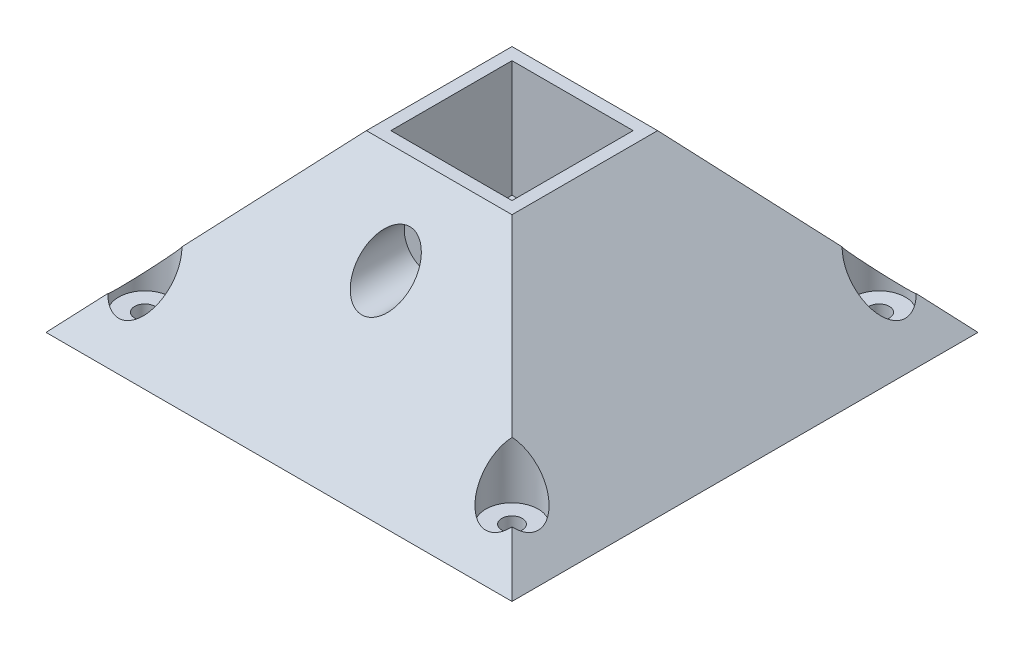
from build123d import *

# Parameters (mm, degrees)
SKETCH3_W          = 20.8
SKETCH3_H          = 20.8
CUT_EXTRUDE1_DEPTH = 20
SKETCH4_R          = 1.75
CUT_EXTRUDE2_DEPTH = 65.031242546
CUT_EXTRUDE5_START = 14
SKETCH4_3_R        = 4.5
SKETCH4_3_R_2      = 1.75
CUT_EXTRUDE5_DEPTH = 51.031242546
SKETCH5_R          = 1.75
CUT_EXTRUDE6_DEPTH = 65.031242546
CUT_EXTRUDE7_START = 3
SKETCH5_3_R        = 4.5
SKETCH5_3_R_2      = 1.75
CUT_EXTRUDE7_DEPTH = 62.031242546
CIRPATTERN1_COUNT  = 4


with BuildPart() as part:
    # Sketch2 → Loft1 section 0
    with BuildSketch(Plane(origin=(0, 30, 0), x_dir=(1, 0, 0), z_dir=(0, 1, 0))):
        with BuildLine():
            Line((12.5, -12.5), (-12.5, -12.5))
            Line((-12.5, -12.5), (-12.5, 12.5))
            Line((-12.5, 12.5), (12.5, 12.5))
            Line((12.5, 12.5), (12.5, -12.5))
        make_face()
    # Sketch1 → Loft1 section 1
    with BuildSketch(Plane(origin=(0, 0, 0), x_dir=(1, 0, 0), z_dir=(0, 1, 0))):
        with BuildLine():
            Line((40, -40), (-40, -40))
            Line((-40, -40), (-40, 40))
            Line((-40, 40), (40, 40))
            Line((40, 40), (40, -40))
        make_face()
    loft()

    # Sketch3 → Cut-Extrude1 (cut)
    with BuildSketch(Plane(origin=(0, 30, 0), x_dir=(1, 0, 0), z_dir=(0, 1, 0))):
        Rectangle(SKETCH3_W, SKETCH3_H)
    extrude(amount=-CUT_EXTRUDE1_DEPTH, mode=Mode.SUBTRACT)

    # Sketch4 → Cut-Extrude2 (cut, through all)
    with BuildSketch(Plane.XY):
        with Locations((0, 20)):
            Circle(SKETCH4_R)
    extrude(amount=CUT_EXTRUDE2_DEPTH, mode=Mode.SUBTRACT)

    # Sketch4<3> → Cut-Extrude5 (cut, through all)
    with BuildSketch(Plane.XY.offset(CUT_EXTRUDE5_START)):
        with Locations((0, 20)):
            Circle(SKETCH4_3_R)
        with Locations((0, 20)):
            Circle(SKETCH4_3_R_2, mode=Mode.SUBTRACT)
    extrude(amount=CUT_EXTRUDE5_DEPTH, mode=Mode.SUBTRACT)

    # Sketch5 → Cut-Extrude6 (cut, through all)
    with BuildSketch(Plane(origin=(0, 0, 0), x_dir=(1, 0, 0), z_dir=(0, 1, 0))):
        with Locations((-31.514718626, 31.514718626)):
            Circle(SKETCH5_R)
    cut_extrude6 = extrude(amount=CUT_EXTRUDE6_DEPTH, mode=Mode.SUBTRACT)

    # Sketch5<3> → Cut-Extrude7 (cut, through all)
    with BuildSketch(Plane(origin=(0, 0, 0), x_dir=(1, 0, 0), z_dir=(0, 1, 0)).offset(CUT_EXTRUDE7_START)):
        with Locations((-31.514718626, 31.514718626)):
            Circle(SKETCH5_3_R)
        with Locations((-31.514718626, 31.514718626)):
            Circle(SKETCH5_3_R_2, mode=Mode.SUBTRACT)
    cut_extrude7 = extrude(amount=CUT_EXTRUDE7_DEPTH, mode=Mode.SUBTRACT)

    # CirPattern1: Cut-Extrude6, Cut-Extrude7 ×4 about axis
    cirpattern1_axis = Axis((0, 0, 0), (0, 1, 0))
    add([cut_extrude6.rotate(cirpattern1_axis, i * 360 / CIRPATTERN1_COUNT) for i in range(1, CIRPATTERN1_COUNT)], mode=Mode.SUBTRACT)
    add([cut_extrude7.rotate(cirpattern1_axis, i * 360 / CIRPATTERN1_COUNT) for i in range(1, CIRPATTERN1_COUNT)], mode=Mode.SUBTRACT)


solid = part.part
